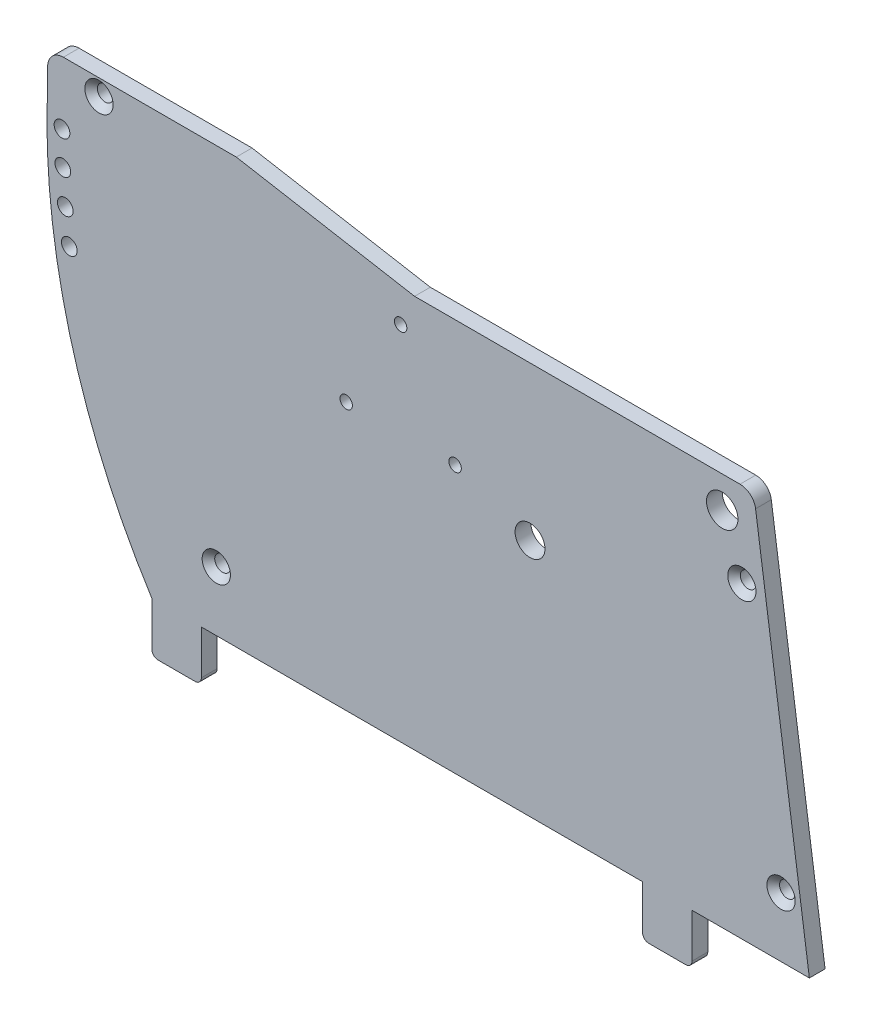
from build123d import *

# Parameters (mm, degrees)
SKETCH18_R          = 3.175
SKETCH18_R_2        = 6.35
SKETCH18_R_3        = 2.5019
BOSS_EXTRUDE4_DEPTH = 6.35
CHAMFER1_SIZE       = 2.54
SKETCH19_R          = 6.0325
CUT_EXTRUDE1_DEPTH  = 43.434
SKETCH20_W          = 20
SKETCH20_H          = 6.35
BOSS_EXTRUDE5_DEPTH = 20.32
FILLET1_R           = 2.54


with BuildPart() as part:
    # Sketch18 → Boss-Extrude4 (new body)
    with BuildSketch(Plane.XY):
        with BuildLine():
            Line((0, 0), (-265.604745697, 0))
            ThreePointArc((-265.604745697, 0), (-298.882523776, 76.131915965), (-307.699061234, 158.75))
            Line((-307.699061234, 158.75), (-307.699061234, 165.1))
            ThreePointArc((-307.699061234, 165.1), (-305.839189294, 169.590128061), (-301.349061234, 171.45))
            Line((-301.349061234, 171.45), (-231.499061234, 171.45))
            Line((-231.499061234, 171.45), (-159.473782125, 158.75))
            Line((-159.473782125, 158.75), (-28.014368889, 158.75))
            ThreePointArc((-28.014368889, 158.75), (-23.851207857, 157.194850386), (-21.727208485, 153.291130779))
            Line((-21.727208485, 153.291130779), (0, 0))
        make_face()
        with Locations((-11.423473622, 24.034728138)):
            Circle(SKETCH18_R, mode=Mode.SUBTRACT)
        with Locations((-27.253356194, 124.406511892)):
            Circle(SKETCH18_R, mode=Mode.SUBTRACT)
        with Locations((-35.200938766, 146.05)):
            Circle(SKETCH18_R_2, mode=Mode.SUBTRACT)
        with Locations((-301.900938766, 146.05)):
            Circle(SKETCH18_R, mode=Mode.SUBTRACT)
        with Locations((-301.569673588, 132.761391752)):
            Circle(SKETCH18_R, mode=Mode.SUBTRACT)
        with Locations((-300.579872803, 119.537524267)):
            Circle(SKETCH18_R, mode=Mode.SUBTRACT)
        with Locations((-298.943543444, 106.442822899)):
            Circle(SKETCH18_R, mode=Mode.SUBTRACT)
        with Locations((-239.568937637, 24.034728138)):
            Circle(SKETCH18_R, mode=Mode.SUBTRACT)
        with Locations((-286.962142025, 164.850708953)):
            Circle(SKETCH18_R, mode=Mode.SUBTRACT)
        with Locations((-165.1, 146.05)):
            Circle(SKETCH18_R_3, mode=Mode.SUBTRACT)
        with Locations((-143.102954744, 107.95)):
            Circle(SKETCH18_R_3, mode=Mode.SUBTRACT)
        with Locations((-187.097045256, 107.95)):
            Circle(SKETCH18_R_3, mode=Mode.SUBTRACT)
    extrude(amount=BOSS_EXTRUDE4_DEPTH)

    # Chamfer1
    chamfer1_edges = [part.edges().sort_by_distance(p)[0] for p in [
        (-14.598473622, 24.034728138, 6.35),
        (-30.428356194, 124.406511892, 6.35),
        (-242.743937637, 24.034728138, 6.35),
        (-290.137142025, 164.850708953, 6.35),
    ]]
    chamfer(chamfer1_edges, length=CHAMFER1_SIZE)

    # Sketch19 → Cut-Extrude1 (cut)
    with BuildSketch(Plane(origin=(0, 0, 0), x_dir=(-1, 0, 0), z_dir=(0, 0, -1))):
        with Locations((112.843509564, 96.674296134)):
            Circle(SKETCH19_R)
    extrude(amount=-CUT_EXTRUDE1_DEPTH, mode=Mode.SUBTRACT)

    # Sketch20 → Boss-Extrude5 (add)
    with BuildSketch(Plane.XZ):
        with Locations((-255.604745697, 3.175)):
            Rectangle(SKETCH20_W, SKETCH20_H)
        with Locations((-57.384832148, 3.175)):
            Rectangle(SKETCH20_W, SKETCH20_H)
    extrude(amount=BOSS_EXTRUDE5_DEPTH)

    # Fillet1
    fillet1_edges = [part.edges().sort_by_distance(p)[0] for p in [
        (-265.604745697, -20.32, 3.175),
        (-245.604745697, -20.32, 3.175),
        (-47.384832148, -20.32, 3.175),
        (-67.384832148, -20.32, 3.175),
    ]]
    fillet(fillet1_edges, radius=FILLET1_R)


solid = part.part
